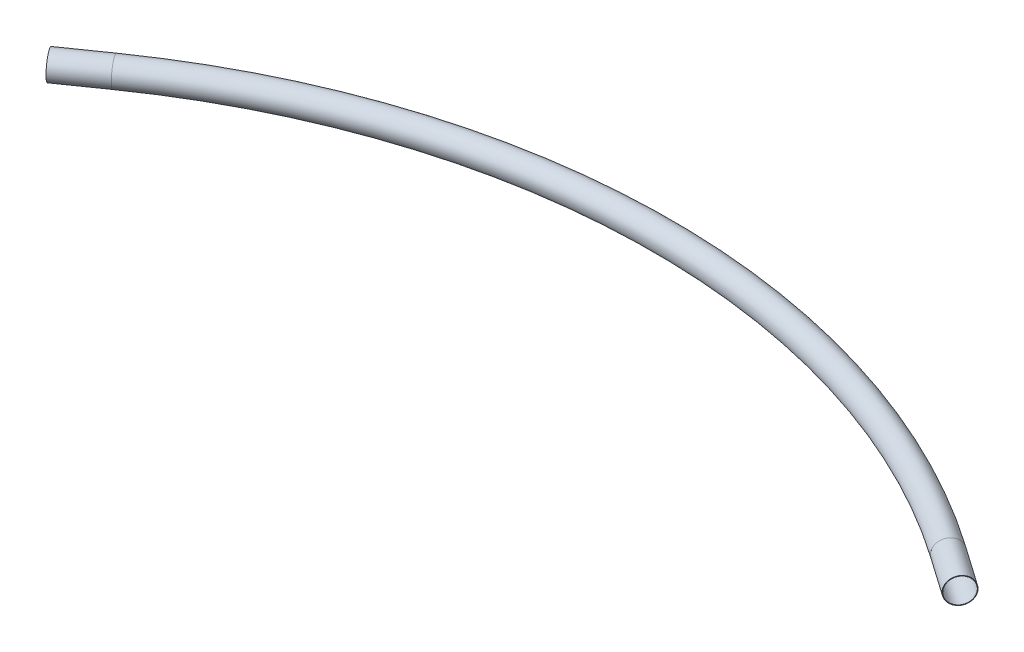
from build123d import *

# Parameters (mm, degrees)
SKETCH12_R                 = 84.1375
SKETCH12_R_2               = 80.7339
STRUCTURAL_MEMBER1_DEPTH   = 304.8
SKETCH12_ON_SEGMENT_2_R    = 84.1375
SKETCH12_ON_SEGMENT_2_R_2  = 80.7339
STRUCTURAL_MEMBER1_2_ANGLE = 69.935267889
SKETCH12_ON_SEGMENT_3_R    = 84.1375
SKETCH12_ON_SEGMENT_3_R_2  = 80.7339
STRUCTURAL_MEMBER1_3_DEPTH = 304.8


with BuildPart() as part:
    # Sketch12 → Structural Member1 (new body)
    with BuildSketch(Plane(origin=(2711.45, 0, 0), x_dir=(-0.5731136105937928, 0, 0.8194759235951635), z_dir=(-0.8194759235951635, 0, -0.5731136105937928))):
        Circle(SKETCH12_R)
        Circle(SKETCH12_R_2, mode=Mode.SUBTRACT)
    extrude(amount=-STRUCTURAL_MEMBER1_DEPTH)


with BuildPart() as body_2:
    # Sketch12 on segment 2 (carried to the start of arc 2) → Structural Member1 2 (revolve)
    with BuildSketch(Plane(origin=(2711.45, 0, 0), x_dir=(0.573113611, 0, -0.819475924), z_dir=(0.819475924, 0, 0.573113611))):
        Circle(SKETCH12_ON_SEGMENT_2_R)
        Circle(SKETCH12_ON_SEGMENT_2_R_2, mode=Mode.SUBTRACT)
    revolve(axis=Axis((0, 0, 3877.011384758), (0, 1, 0)), revolution_arc=STRUCTURAL_MEMBER1_2_ANGLE)


with BuildPart() as body_3:
    # Sketch12 on segment 3 (carried to segment 3) → Structural Member1 3 (new body)
    with BuildSketch(Plane(origin=(-2961.226261512, 0, 174.685028509), x_dir=(-0.573113611, 0, -0.819475924), z_dir=(0.819475924, 0, -0.573113611))):
        Circle(SKETCH12_ON_SEGMENT_3_R)
        Circle(SKETCH12_ON_SEGMENT_3_R_2, mode=Mode.SUBTRACT)
    extrude(amount=STRUCTURAL_MEMBER1_3_DEPTH)


solid = Compound([part.part, body_2.part, body_3.part])
